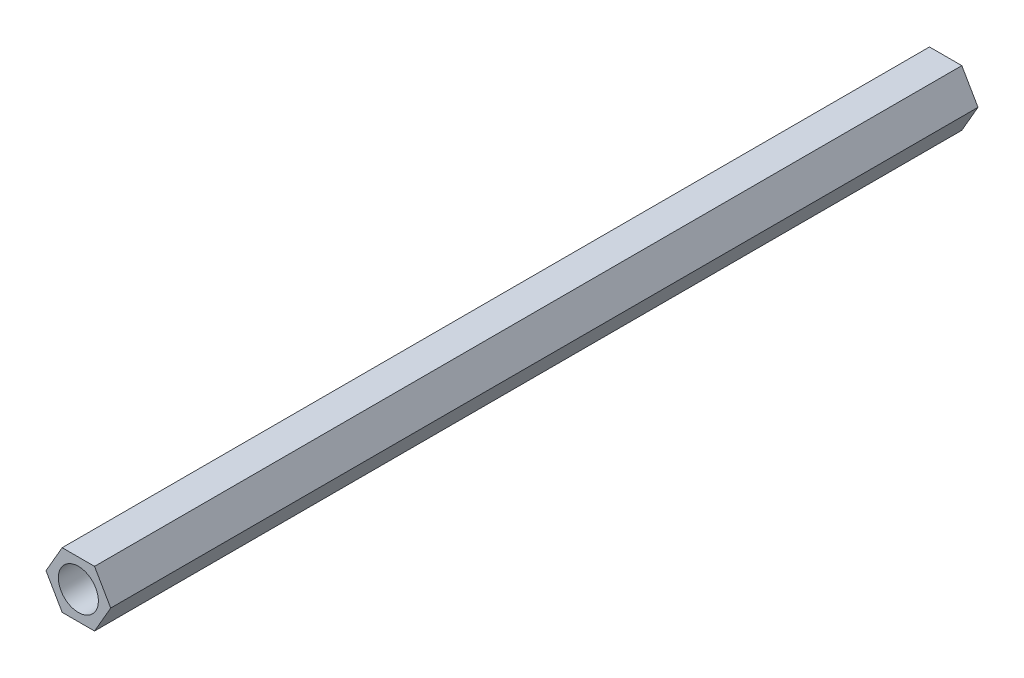
from build123d import *

# Parameters (mm, degrees)
SKETCH_1_R      = 1.5
EXTRUDE_1_DEPTH = 65


with BuildPart() as part:
    # 草图1 → 凸台-拉伸1 (new body)
    with BuildSketch(Plane.XY):
        Polygon((2.424871131, 0), (1.212435565, 2.1), (-1.212435565, 2.1), (-2.424871131, 0), (-1.212435565, -2.1), (1.212435565, -2.1), align=None)
        Circle(SKETCH_1_R, mode=Mode.SUBTRACT)
    extrude(amount=EXTRUDE_1_DEPTH)


solid = part.part
